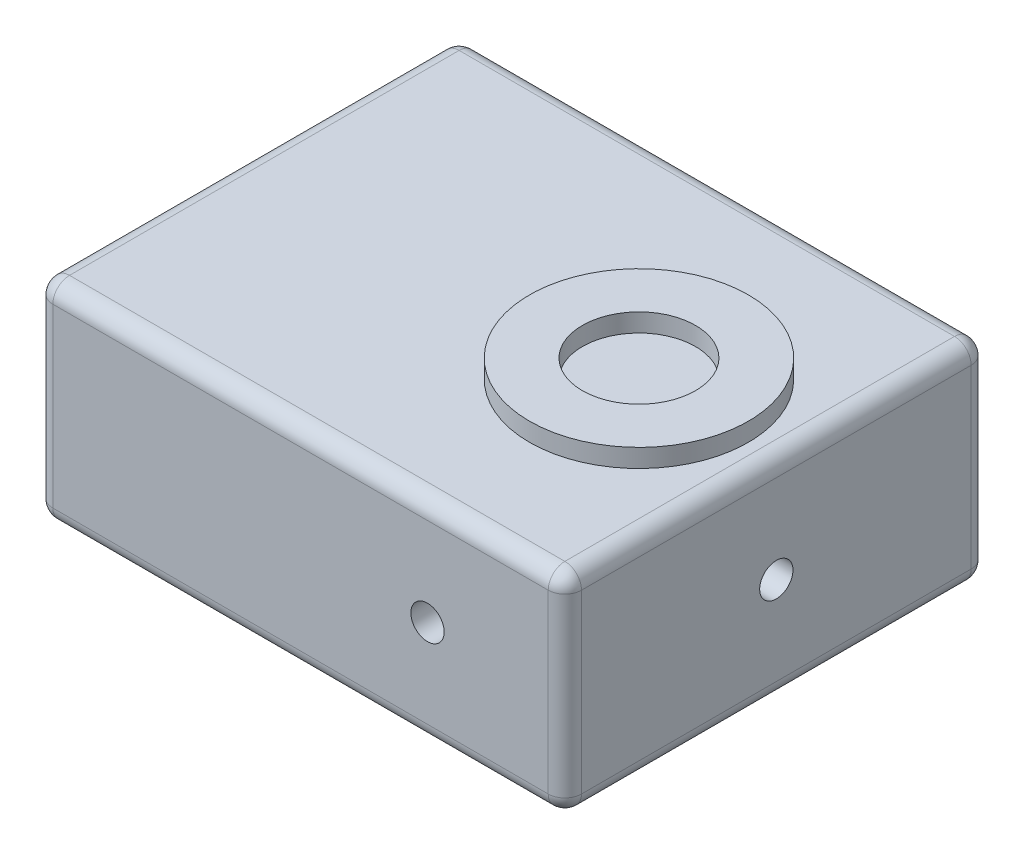
from build123d import *

# Parameters (mm, degrees)
SKETCH1_W           = 63.5
SKETCH1_H           = 50.8
BOSS_EXTRUDE1_DEPTH = 25.2
SKETCH2_R           = 13.1445
SKETCH2_R_2         = 6.7945
BOSS_EXTRUDE2_DEPTH = 2.2
SKETCH3_R           = 2
CUT_EXTRUDE1_DEPTH  = 5.5
SKETCH4_R           = 2
CUT_EXTRUDE2_DEPTH  = 5.5
CUT_EXTRUDE3_START  = -5.5
SKETCH5_R           = 2
CUT_EXTRUDE3_DEPTH  = 5.5
FILLET1_R           = 2
SKETCH6_W           = 18
SKETCH6_H           = 12
BOSS_EXTRUDE3_DEPTH = 1


with BuildPart() as part:
    # Sketch1 → Boss-Extrude1 (new body)
    with BuildSketch(Plane(origin=(0, 0, 0), x_dir=(1, 0, 0), z_dir=(0, 1, 0))):
        Rectangle(SKETCH1_W, SKETCH1_H)
    extrude(amount=BOSS_EXTRUDE1_DEPTH)

    # Sketch2 → Boss-Extrude2 (add)
    with BuildSketch(Plane(origin=(0, 25.2, 0), x_dir=(1, 0, 0), z_dir=(0, 1, 0))):
        with Locations(Location((15.25, 0, 0), (0, 0, 90))):
            Circle(SKETCH2_R)
        with Locations(Location((15.25, 0, 0), (0, 0, 270))):
            Circle(SKETCH2_R_2, mode=Mode.SUBTRACT)
    extrude(amount=BOSS_EXTRUDE2_DEPTH)

    # Sketch3 → Cut-Extrude1 (cut)
    with BuildSketch(Plane.XY.offset(25.4)):
        with Locations((15.25, 12.6)):
            Circle(SKETCH3_R)
    extrude(amount=-CUT_EXTRUDE1_DEPTH, mode=Mode.SUBTRACT)

    # Sketch4 → Cut-Extrude2 (cut)
    with BuildSketch(Plane(origin=(31.75, 0, 0), x_dir=(0, 0, -1), z_dir=(1, 0, 0))):
        with Locations((0, 12.6)):
            Circle(SKETCH4_R)
    extrude(amount=-CUT_EXTRUDE2_DEPTH, mode=Mode.SUBTRACT)

    # Sketch5 → Cut-Extrude3 (cut)
    with BuildSketch(Plane(origin=(0, 0, -25.4), x_dir=(-1, 0, 0), z_dir=(0, 0, -1)).offset(CUT_EXTRUDE3_START)):
        with Locations(Location((-15.25, 12.6, 0), (0, 0, 180))):
            Circle(SKETCH5_R)
    extrude(amount=CUT_EXTRUDE3_DEPTH, mode=Mode.SUBTRACT)

    # Fillet1
    fillet1_edges = [part.edges().sort_by_distance(p)[0] for p in [
        (-31.75, 25.2, 0),
        (0, 25.2, 25.4),
        (31.75, 25.2, 0),
        (0, 0, 25.4),
        (-31.75, 0, 0),
        (0, 0, -25.4),
        (31.75, 0, 0),
        (0, 25.2, -25.4),
        (31.75, 12.6, 25.4),
        (-31.75, 12.6, 25.4),
        (-31.75, 12.6, -25.4),
        (31.75, 12.6, -25.4),
    ]]
    fillet(fillet1_edges, radius=FILLET1_R)

    # Sketch6 → Boss-Extrude3 (add)
    with BuildSketch(Plane(origin=(0, 0, -25.4), x_dir=(-1, 0, 0), z_dir=(0, 0, -1))):
        with Locations((16.25, 8.5)):
            Rectangle(SKETCH6_W, SKETCH6_H)
    extrude(amount=BOSS_EXTRUDE3_DEPTH)


solid = part.part
